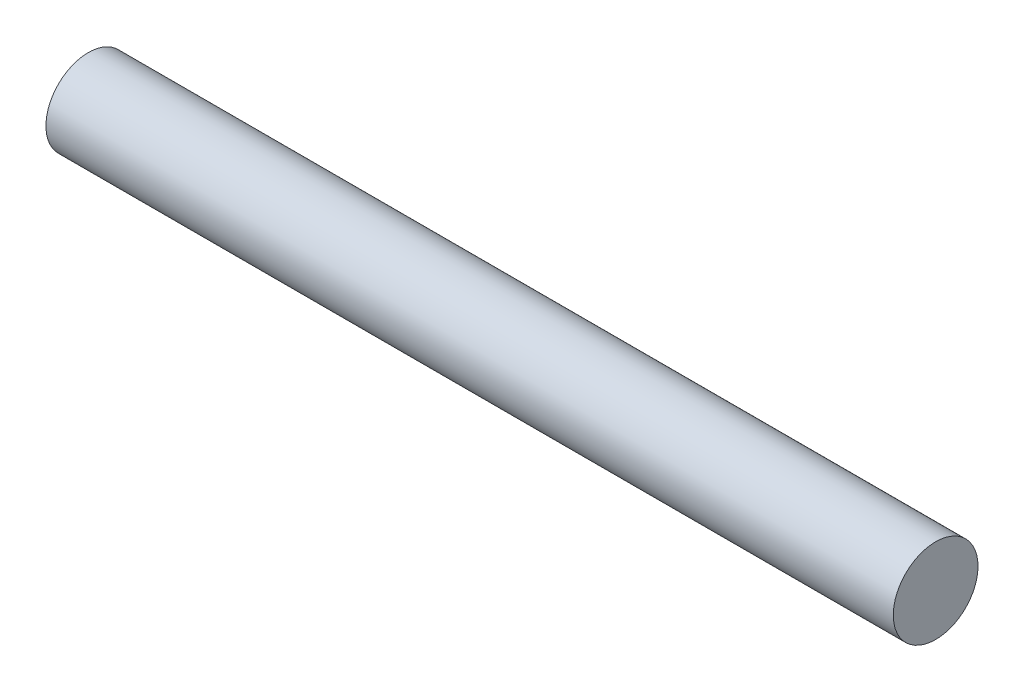
from build123d import *

# Parameters (mm, degrees)
SKETCH1_R           = 2.5
BOSS_EXTRUDE1_DEPTH = 25


with BuildPart() as part:
    # Sketch1 → Boss-Extrude1 (new, symmetric)
    with BuildSketch(Plane(origin=(0, 0, 0), x_dir=(0, 0, -1), z_dir=(1, 0, 0))):
        Circle(SKETCH1_R)
    extrude(amount=BOSS_EXTRUDE1_DEPTH, both=True)


solid = part.part
